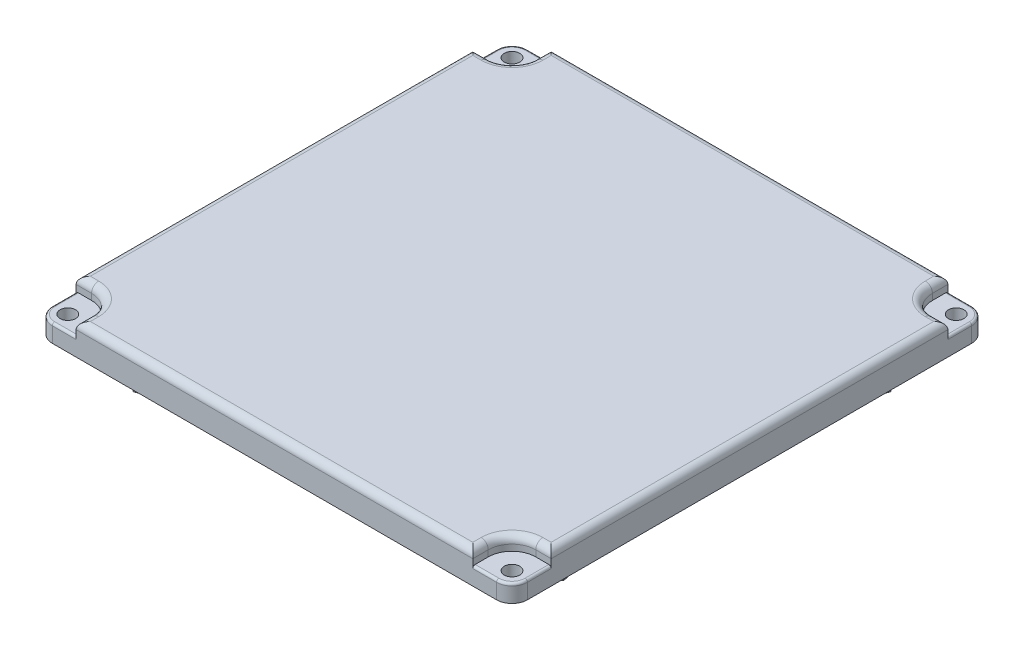
from build123d import *

# Parameters (mm, degrees)
SKETCH1_W           = 100
SKETCH1_H           = 100
BOSS_EXTRUDE1_DEPTH = 53.5
SKETCH2_R           = 2.5
SKETCH2_W           = 12.6
SKETCH2_H           = 3.072407599
BOSS_EXTRUDE2_DEPTH = 4
CUT_EXTRUDE1_DEPTH  = 47.5
FILLET1_R           = 3.25
FILLET2_R           = 3
SKETCH4_R           = 1.625
CUT_EXTRUDE2_DEPTH  = 14
FILLET3_R           = 3
BOSS_EXTRUDE3_START = 6.5
SKETCH8_R           = 1.625
BOSS_EXTRUDE3_DEPTH = 6.5
SKETCH10_W          = 159.412029064
SKETCH10_H          = 131.965012122
CUT_EXTRUDE3_DEPTH  = 205.5
SKETCH11_R          = 1.625
CUT_EXTRUDE4_DEPTH  = 2.8
FILLET4_R           = 1.5
FILLET5_R           = 0.5
BOSS_EXTRUDE4_DEPTH = 5
FILLET6_R           = 0.5
CUT_EXTRUDE5_DEPTH  = 130
CUT_EXTRUDE6_DEPTH  = 130


with BuildPart() as part:
    # Sketch1 → Boss-Extrude1 (new body)
    with BuildSketch(Plane(origin=(0, 0, 0), x_dir=(1, 0, 0), z_dir=(0, 1, 0))):
        Rectangle(SKETCH1_W, SKETCH1_H)
    extrude(amount=BOSS_EXTRUDE1_DEPTH)

    # Sketch2 → Boss-Extrude2 (add)
    # profile 1 of 8: a face of its own
    with BuildSketch(Plane.XZ):
        with BuildLine():
            Line((33.15, -50), (20.55, -50))
            Line((20.55, -50), (20.55, -56.973787721))
            ThreePointArc((20.55, -56.973787721), (26.85, -63.273787721), (33.15, -56.973787721))
            Line((33.15, -56.973787721), (33.15, -50))
        make_face()
        with Locations(Location((26.85, -56.973787721, 0), (0, 0, 270))):
            Circle(SKETCH2_R, mode=Mode.SUBTRACT)
    # profile 2 of 8: a face of its own
    with BuildSketch(Plane.XZ):
        with BuildLine():
            Line((-20.55, -56.973787721), (-20.55, -50))
            Line((-20.55, -50), (-33.15, -50))
            Line((-33.15, -50), (-33.15, -56.973787721))
            ThreePointArc((-33.15, -56.973787721), (-26.85, -63.273787721), (-20.55, -56.973787721))
        make_face()
        with Locations(Location((-26.85, -56.973787721, 0), (0, 0, 270))):
            Circle(SKETCH2_R, mode=Mode.SUBTRACT)
    # profile 3 of 8: a face of its own
    with BuildSketch(Plane.XZ):
        with Locations((-26.85, 48.4637962)):
            Rectangle(SKETCH2_W, SKETCH2_H)
    # profile 4 of 8: a face of its own
    with BuildSketch(Plane.XZ):
        with BuildLine():
            Line((-33.15, 50), (-20.55, 50))
            Line((-20.55, 50), (-20.55, 56.973787721))
            ThreePointArc((-20.55, 56.973787721), (-26.85, 63.273787721), (-33.15, 56.973787721))
            Line((-33.15, 56.973787721), (-33.15, 50))
        make_face()
        with Locations(Location((-26.85, 56.973787721, 0), (0, 0, 270))):
            Circle(SKETCH2_R, mode=Mode.SUBTRACT)
    # profile 5 of 8: a face of its own
    with BuildSketch(Plane.XZ):
        with BuildLine():
            Line((20.55, 56.973787721), (20.55, 50))
            Line((20.55, 50), (33.15, 50))
            Line((33.15, 50), (33.15, 56.973787721))
            ThreePointArc((33.15, 56.973787721), (26.85, 63.273787721), (20.55, 56.973787721))
        make_face()
        with Locations(Location((26.85, 56.973787721, 0), (0, 0, 270))):
            Circle(SKETCH2_R, mode=Mode.SUBTRACT)
    # profile 6 of 8: a face of its own
    with BuildSketch(Plane.XZ):
        with Locations((26.85, 48.4637962)):
            Rectangle(SKETCH2_W, SKETCH2_H)
    # profile 7 of 8: a face of its own
    with BuildSketch(Plane.XZ):
        with Locations((26.85, -48.4637962)):
            Rectangle(SKETCH2_W, SKETCH2_H)
    # profile 8 of 8: a face of its own
    with BuildSketch(Plane.XZ):
        with Locations((-26.85, -48.4637962)):
            Rectangle(SKETCH2_W, SKETCH2_H)
    extrude(amount=-BOSS_EXTRUDE2_DEPTH)

    # Sketch3 → Cut-Extrude1 (cut)
    with BuildSketch(Plane(origin=(0, 53.5, 0), x_dir=(1, 0, 0), z_dir=(0, 1, 0))):
        Polygon((35.565, 48), (-35.565, 48), (-48, 35.565), (-48, -35.565), (-35.565, -48), (35.565, -48), (48, -35.565), (48, 35.565), align=None)
    extrude(amount=-CUT_EXTRUDE1_DEPTH, mode=Mode.SUBTRACT)

    # Fillet1
    fillet1_edges = [part.edges().sort_by_distance(p)[0] for p in [
        (50, 26.75, 50),
        (-50, 26.75, 50),
        (-50, 26.75, -50),
        (50, 26.75, -50),
    ]]
    fillet(fillet1_edges, radius=FILLET1_R)

    # Fillet2
    fillet2_edges = [part.edges().sort_by_distance(p)[0] for p in [
        (-26.85, 4, 50),
        (26.85, 4, 50),
        (26.85, 4, -50),
        (-26.85, 4, -50),
    ]]
    fillet(fillet2_edges, radius=FILLET2_R)

    # Sketch4 → Cut-Extrude2 (cut)
    with BuildSketch(Plane(origin=(0, 53.5, 0), x_dir=(1, 0, 0), z_dir=(0, 1, 0))):
        with Locations(Location((-46.75, 46.75, 0), (0, 0, 270))):
            Circle(SKETCH4_R)
        with Locations(Location((46.75, 46.75, 0), (0, 0, 270))):
            Circle(SKETCH4_R)
        with Locations(Location((46.75, -46.75, 0), (0, 0, 270))):
            Circle(SKETCH4_R)
        with Locations(Location((-46.75, -46.75, 0), (0, 0, 270))):
            Circle(SKETCH4_R)
    extrude(amount=-CUT_EXTRUDE2_DEPTH, mode=Mode.SUBTRACT)

    # Fillet3
    fillet3_edges = [part.edges().sort_by_distance(p)[0] for p in [
        (50, 0, 0),
        (39.95, 0, -50),
        (-39.95, 0, 50),
        (-50, 0, 0),
        (49.048097039, 0, -49.048097039),
        (-49.048097039, 0, -49.048097039),
        (-49.048097039, 0, 49.048097039),
        (49.048097039, 0, 49.048097039),
        (0, 0, 50),
        (39.95, 0, 50),
        (0, 0, -50),
        (-39.95, 0, -50),
    ]]
    fillet(fillet3_edges, radius=FILLET3_R)

    # Sketch8 → Boss-Extrude3 (add)
    # profile 1 of 2: a face of its own
    with BuildSketch(Plane(origin=(0, 53.5, 0), x_dir=(1, 0, 0), z_dir=(0, 1, 0)).offset(BOSS_EXTRUDE3_START)):
        with BuildLine():
            ThreePointArc((-50, -46.75), (-49.048097039, -49.048097039), (-46.75, -50))
            Line((-46.75, -50), (46.75, -50))
            ThreePointArc((46.75, -50), (49.048097039, -49.048097039), (50, -46.75))
            Line((50, -46.75), (50, 46.75))
            ThreePointArc((50, 46.75), (49.048097039, 49.048097039), (46.75, 50))
            Line((46.75, 50), (-46.75, 50))
            ThreePointArc((-46.75, 50), (-49.048097039, 49.048097039), (-50, 46.75))
            Line((-50, 46.75), (-50, -46.75))
        make_face()
        with Locations(Location((-46.75, 46.75, 0), (0, 0, 270))):
            Circle(SKETCH8_R, mode=Mode.SUBTRACT)
        with Locations(Location((46.75, 46.75, 0), (0, 0, 270))):
            Circle(SKETCH8_R, mode=Mode.SUBTRACT)
        with Locations(Location((-46.75, -46.75, 0), (0, 0, 270))):
            Circle(SKETCH8_R, mode=Mode.SUBTRACT)
        with Locations(Location((46.75, -46.75, 0), (0, 0, 270))):
            Circle(SKETCH8_R, mode=Mode.SUBTRACT)
        Polygon((-35.565, 48), (35.565, 48), (48, 35.565), (48, -35.565), (35.565, -48), (-35.565, -48), (-48, -35.565), (-48, 35.565), align=None, mode=Mode.SUBTRACT)
    # profile 2 of 2: a face of its own
    with BuildSketch(Plane(origin=(0, 53.5, 0), x_dir=(1, 0, 0), z_dir=(0, 1, 0)).offset(BOSS_EXTRUDE3_START)):
        Polygon((35.565, 48), (48, 35.565), (48, -35.565), (35.565, -48), (-35.565, -48), (-48, -35.565), (-48, 35.565), (-35.565, 48), align=None)
    extrude(amount=-BOSS_EXTRUDE3_DEPTH)

    # Sketch10 → Cut-Extrude3 (cut)
    with BuildSketch(Plane.XZ.offset(-53.5)):
        Rectangle(SKETCH10_W, SKETCH10_H)
    extrude(amount=CUT_EXTRUDE3_DEPTH, mode=Mode.SUBTRACT)

    # Sketch11 → Cut-Extrude4 (cut)
    # profile 1 of 4: a face of its own
    with BuildSketch(Plane(origin=(0, 60, 0), x_dir=(1, 0, 0), z_dir=(0, 1, 0))):
        with BuildLine():
            Line((-46.75, -41.75), (-50, -41.75))
            Line((-50, -41.75), (-50, -46.75))
            ThreePointArc((-50, -46.75), (-49.048097039, -49.048097039), (-46.75, -50))
            Line((-46.75, -50), (-41.75, -50))
            Line((-41.75, -50), (-41.75, -46.75))
            ThreePointArc((-41.75, -46.75), (-43.214466094, -43.214466094), (-46.75, -41.75))
        make_face()
        with Locations(Location((-46.75, -46.75, 0), (0, 0, 270))):
            Circle(SKETCH11_R, mode=Mode.SUBTRACT)
    # profile 2 of 4: a face of its own
    with BuildSketch(Plane(origin=(0, 60, 0), x_dir=(1, 0, 0), z_dir=(0, 1, 0))):
        with BuildLine():
            Line((-50, 41.75), (-46.75, 41.75))
            ThreePointArc((-46.75, 41.75), (-43.214466094, 43.214466094), (-41.75, 46.75))
            Line((-41.75, 46.75), (-41.75, 50))
            Line((-41.75, 50), (-46.75, 50))
            ThreePointArc((-46.75, 50), (-49.048097039, 49.048097039), (-50, 46.75))
            Line((-50, 46.75), (-50, 41.75))
        make_face()
        with Locations(Location((-46.75, 46.75, 0), (0, 0, 270))):
            Circle(SKETCH11_R, mode=Mode.SUBTRACT)
    # profile 3 of 4: a face of its own
    with BuildSketch(Plane(origin=(0, 60, 0), x_dir=(1, 0, 0), z_dir=(0, 1, 0))):
        with BuildLine():
            Line((46.75, 50), (41.75, 50))
            Line((41.75, 50), (41.75, 46.75))
            ThreePointArc((41.75, 46.75), (43.214466094, 43.214466094), (46.75, 41.75))
            Line((46.75, 41.75), (50, 41.75))
            Line((50, 41.75), (50, 46.75))
            ThreePointArc((50, 46.75), (49.048097039, 49.048097039), (46.75, 50))
        make_face()
        with Locations(Location((46.75, 46.75, 0), (0, 0, 270))):
            Circle(SKETCH11_R, mode=Mode.SUBTRACT)
    # profile 4 of 4: a face of its own
    with BuildSketch(Plane(origin=(0, 60, 0), x_dir=(1, 0, 0), z_dir=(0, 1, 0))):
        with BuildLine():
            Line((41.75, -46.75), (41.75, -50))
            Line((41.75, -50), (46.75, -50))
            ThreePointArc((46.75, -50), (49.048097039, -49.048097039), (50, -46.75))
            Line((50, -46.75), (50, -41.75))
            Line((50, -41.75), (46.75, -41.75))
            ThreePointArc((46.75, -41.75), (43.214466094, -43.214466094), (41.75, -46.75))
        make_face()
        with Locations(Location((46.75, -46.75, 0), (0, 0, 270))):
            Circle(SKETCH11_R, mode=Mode.SUBTRACT)
    extrude(amount=-CUT_EXTRUDE4_DEPTH, mode=Mode.SUBTRACT)

    # Fillet4
    fillet4_edges = [part.edges().sort_by_distance(p)[0] for p in [
        (0, 60, 50),
        (50, 60, 0),
        (0, 60, -50),
        (-50, 60, 0),
        (48.375, 60, 41.75),
        (41.75, 60, 48.375),
        (43.214466094, 60, 43.214466094),
        (43.214466094, 60, -43.214466094),
        (48.375, 60, -41.75),
        (41.75, 60, -48.375),
        (-48.375, 60, -41.75),
        (-41.75, 60, -48.375),
        (-43.214466094, 60, -43.214466094),
        (-43.214466094, 60, 43.214466094),
        (-48.375, 60, 41.75),
        (-41.75, 60, 48.375),
    ]]
    fillet(fillet4_edges, radius=FILLET4_R)

    # Fillet5
    fillet5_edges = [part.edges().sort_by_distance(p)[0] for p in [
        (50, 57.2, 44.25),
        (49.048097039, 57.2, 49.048097039),
        (44.25, 57.2, 50),
        (44.25, 57.2, -50),
        (49.048097039, 57.2, -49.048097039),
        (50, 57.2, -44.25),
        (-50, 57.2, -44.25),
        (-49.048097039, 57.2, -49.048097039),
        (-44.25, 57.2, -50),
        (-44.25, 57.2, 50),
        (-49.048097039, 57.2, 49.048097039),
        (-50, 57.2, 44.25),
    ]]
    fillet(fillet5_edges, radius=FILLET5_R)

    # Sketch12 → Boss-Extrude4 (add)
    with BuildSketch(Plane.XZ.offset(-53.5)):
        Polygon((-45.3, -34.446623382), (-34.446623382, -45.3), (34.446623382, -45.3), (45.3, -34.446623382), (45.3, 34.446623382), (34.446623382, 45.3), (-34.446623382, 45.3), (-45.3, 34.446623382), align=None)
        Polygon((-33.411089476, -42.8), (33.411089476, -42.8), (42.8, -33.411089476), (42.8, 33.411089476), (33.411089476, 42.8), (-33.411089476, 42.8), (-42.8, 33.411089476), (-42.8, -33.411089476), align=None, mode=Mode.SUBTRACT)
    extrude(amount=BOSS_EXTRUDE4_DEPTH)

    # Fillet6
    fillet6_edges = [part.edges().sort_by_distance(p)[0] for p in [
        (0, 53.5, -42.8),
        (38.105544738, 53.5, -38.105544738),
        (42.8, 53.5, 0),
        (38.105544738, 53.5, 38.105544738),
        (0, 53.5, 42.8),
        (-38.105544738, 53.5, 38.105544738),
        (-42.8, 53.5, 0),
        (-38.105544738, 53.5, -38.105544738),
    ]]
    fillet(fillet6_edges, radius=FILLET6_R)

    # Sketch13 → Cut-Extrude5 (cut)
    with BuildSketch(Plane.ZY.offset(45.3)):
        Polygon((-34.446623382, 48.5), (-26.446623382, 50.5), (26.446623382, 50.5), (34.446623382, 48.5), align=None)
    extrude(amount=-CUT_EXTRUDE5_DEPTH, mode=Mode.SUBTRACT)

    # Sketch14 → Cut-Extrude6 (cut)
    with BuildSketch(Plane.XY.offset(45.3)):
        Polygon((-34.446623382, 48.5), (-26.700656689, 50.5), (28.522356043, 50.5), (36.268322735, 48.5), align=None)
    extrude(amount=-CUT_EXTRUDE6_DEPTH, mode=Mode.SUBTRACT)


solid = part.part
